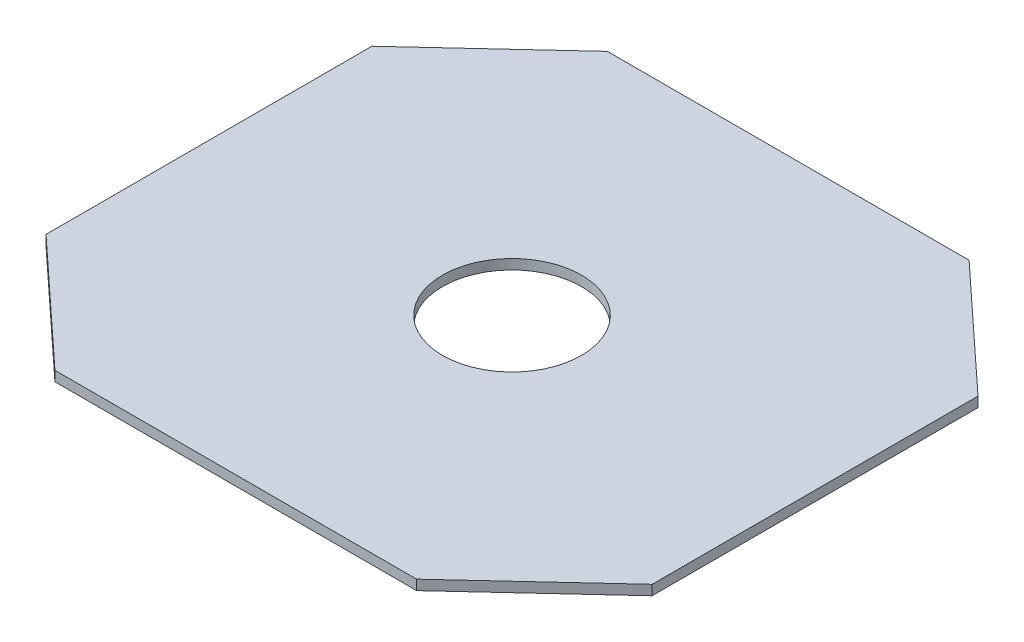
from build123d import *

# Parameters (mm, degrees)
SKETCH_1_R      = 35
EXTRUDE_1_DEPTH = 5


with BuildPart() as part:
    # Эскиз1 → Вытянуть1 (new body)
    with BuildSketch(Plane(origin=(0, 0, 0), x_dir=(1, 0, 0), z_dir=(0, 1, 0))):
        Polygon((-151.693051502, 77.916478726), (-151.693051502, -86.083521274), (-90.193051502, -143.083521274), (91.806948498, -143.083521274), (153.306948498, -86.083521274), (153.306948498, 77.916478726), (91.806948498, 134.916478726), (-90.193051502, 134.916478726), align=None)
        with Locations(Location((0.806948498, -4.083521274, 0), (0, 0, 270))):
            Circle(SKETCH_1_R, mode=Mode.SUBTRACT)
    extrude(amount=EXTRUDE_1_DEPTH)


solid = part.part
